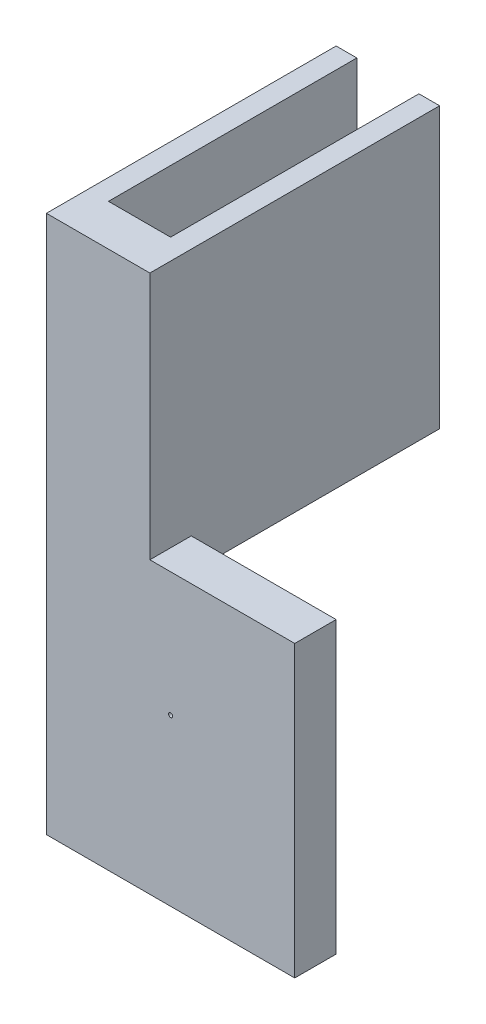
from build123d import *

# Parameters (mm, degrees)
ESQUISSE1_W      = 60
ESQUISSE1_H      = 70
EXTRUSION1_DEPTH = 10
EXTRUSION2_REACH = 53.55
ESQUISSE2_R      = 0.5
ESQUISSE4_W      = 25
ESQUISSE4_H      = 10
EXTRUSION3_DEPTH = 60
EXTRUSION4_DEPTH = 60


with BuildPart() as part:
    # Esquisse1 → Extrusion1 (new body)
    with BuildSketch(Plane.XY):
        with Locations((-4.316825769, -2.145652174)):
            Rectangle(ESQUISSE1_W, ESQUISSE1_H)
    extrude(amount=EXTRUSION1_DEPTH)

    # Esquisse2 → Extrusion2 (cut, up to next)
    with BuildSketch(Plane(origin=(0, 0, 0), x_dir=(-1, 0, 0), z_dir=(0, 0, -1)), mode=Mode.PRIVATE) as extrusion2_sk1:
        with Locations((4.316825769, 2.854347826)):
            Circle(ESQUISSE2_R)
    extrusion2_tool1 = extrude(extrusion2_sk1.sketch, amount=-EXTRUSION2_REACH, mode=Mode.PRIVATE) & part.part
    add(extrusion2_tool1.solids().sort_by_distance((-4.316826, 2.854348, 0))[0], mode=Mode.SUBTRACT)

    # Esquisse4 → Extrusion3 (add)
    with BuildSketch(Plane(origin=(0, 32.854347826, 0), x_dir=(1, 0, 0), z_dir=(0, 1, 0))):
        with Locations((-21.816825769, -5)):
            Rectangle(ESQUISSE4_W, ESQUISSE4_H)
    extrude(amount=EXTRUSION3_DEPTH)

    # Esquisse5 → Extrusion4 (add)
    with BuildSketch(Plane(origin=(0, 0, 0), x_dir=(-1, 0, 0), z_dir=(0, 0, -1))):
        Polygon((29.316825769, 25.271005401), (24.959851341, 12.996610653), (29.400349472, 11.420391442), (34.316825769, 25.271005401), (34.316825769, 92.854347826), (29.316825769, 92.854347826), align=None)
        Polygon((9.316825769, 92.854347826), (14.316825769, 92.854347826), (14.316825769, 23.566663003), (9.316825769, 25.271005401), align=None)
    extrude(amount=EXTRUSION4_DEPTH)


solid = part.part
